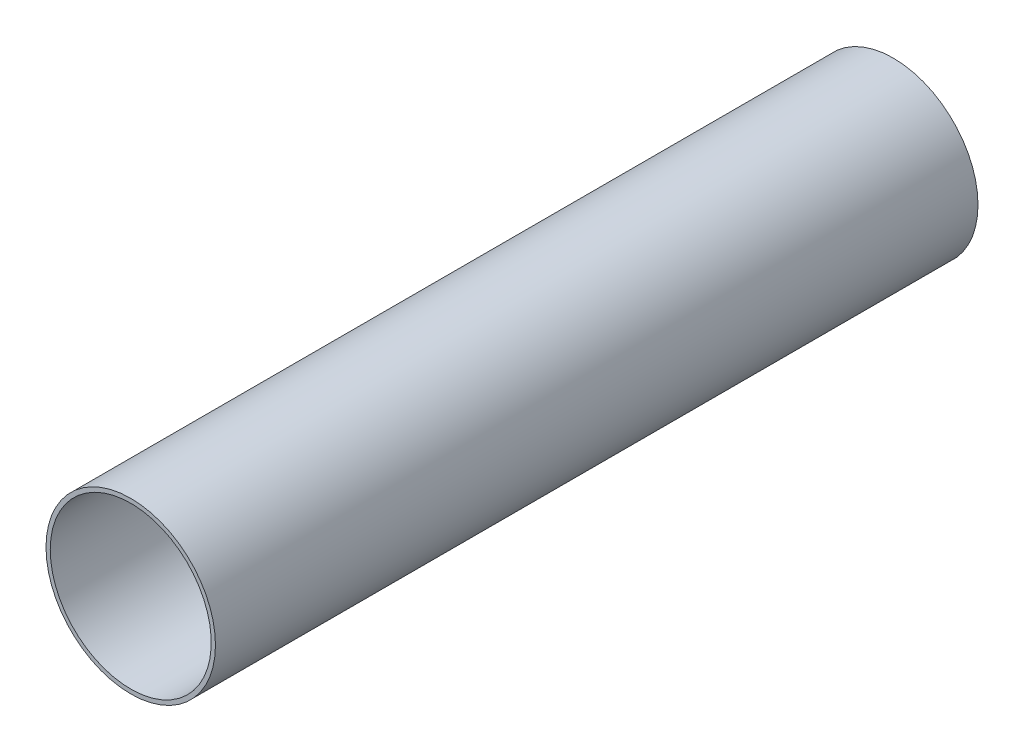
from build123d import *

# Parameters (mm, degrees)
SKETCH_1_R      = 10
SKETCH_1_R_2    = 9.5
EXTRUDE_1_DEPTH = 90


with BuildPart() as part:
    # 草图1 → 凸台-拉伸1 (new body)
    with BuildSketch(Plane.XY):
        with Locations(Location((0, 0, 0), (0, 0, 180))):
            Circle(SKETCH_1_R)
        with Locations(Location((0, 0, 0), (0, 0, 180))):
            Circle(SKETCH_1_R_2, mode=Mode.SUBTRACT)
    extrude(amount=EXTRUDE_1_DEPTH)


solid = part.part
